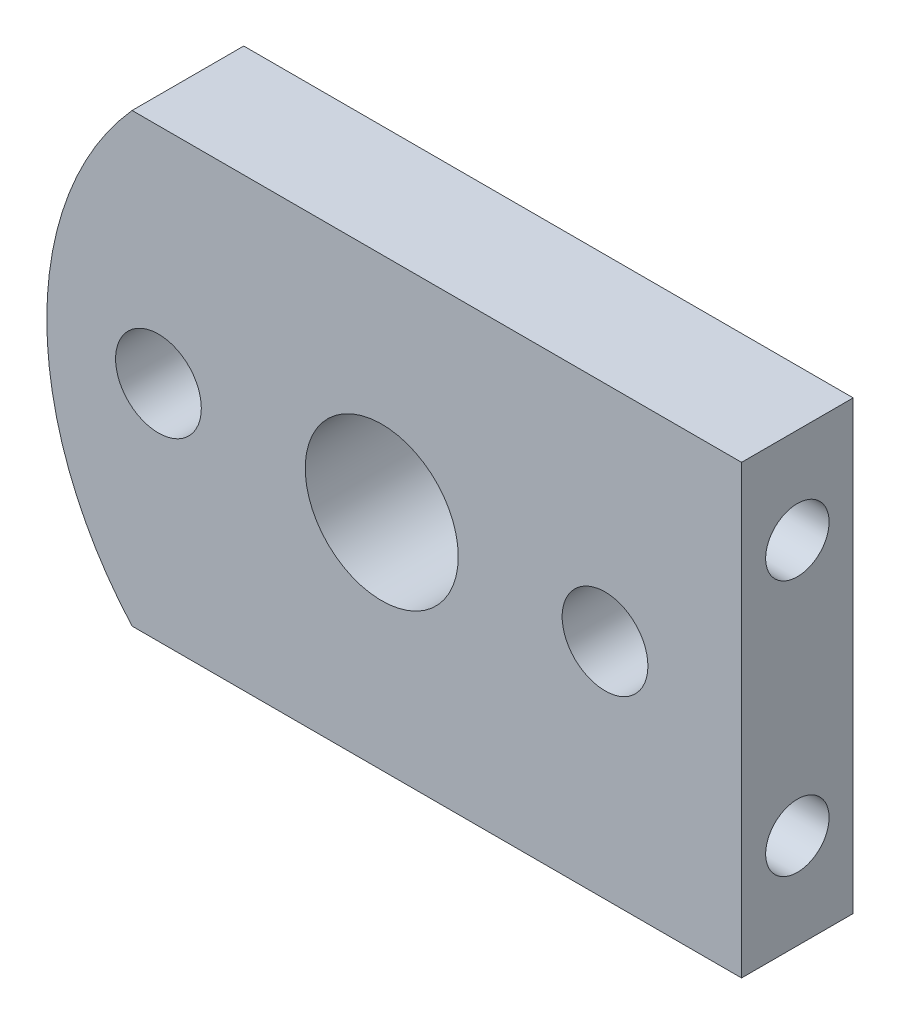
from build123d import *

# Parameters (mm, degrees)
SKETCH1_W                     = 44.45
SKETCH1_H                     = 23.0124
BOSS_EXTRUDE1_DEPTH           = 4.7625
F_1_4_CLEARANCE_HOLE1_D       = 6.5278
F_6_CLEARANCE_HOLE1_D         = 3.6576
CUT_EXTRUDE1_DEPTH            = 51.279761933
TAP_DRILL_FOR_6_32_TAP1_D     = 2.7051
TAP_DRILL_FOR_6_32_TAP1_DEPTH = 12.7
TAP_DRILL_FOR_6_32_TAP1_TIP   = 0.81269403


with BuildPart() as part:
    # Sketch1 → Boss-Extrude1 (new body)
    with BuildSketch(Plane.XY):
        with Locations((22.225, 11.5062)):
            Rectangle(SKETCH1_W, SKETCH1_H)
    extrude(amount=BOSS_EXTRUDE1_DEPTH)

    # 1/4 Clearance Hole1 (through all)
    with Locations(Plane.XY.offset(4.7625)):
        with Locations((29.1015, 10.3124)):
            Hole(F_1_4_CLEARANCE_HOLE1_D / 2)

    # #6 Clearance Hole1 (through all)
    with Locations(Plane.XY.offset(4.7625)):
        with Locations((19.5765, 10.3124), (38.6265, 10.3124)):
            Hole(F_6_CLEARANCE_HOLE1_D / 2)

    # Sketch7 → Cut-Extrude1 (cut, through all)
    with BuildSketch(Plane.XY.offset(4.7625)):
        with BuildLine():
            Line((18.452226257, 0.7874), (44.45, 0.7874))
            Line((44.45, 0.7874), (44.45, 0))
            Line((44.45, 0), (0, 0))
            Line((0, 0), (0, 23.0124))
            Line((0, 23.0124), (44.45, 23.0124))
            Line((44.45, 23.0124), (44.45, 19.8374))
            Line((44.45, 19.8374), (18.452226257, 19.8374))
            ThreePointArc((18.452226257, 19.8374), (14.814, 10.3124), (18.452226257, 0.7874))
        make_face()
    extrude(amount=-CUT_EXTRUDE1_DEPTH, mode=Mode.SUBTRACT)

    # Tap Drill for #6-32 Tap1
    with Locations(Plane(origin=(44.45, 0, 0), x_dir=(0, 0, -1), z_dir=(1, 0, 0))):
        with Locations((-2.38125, 4.8514), (-2.38125, 15.7734)):
            Hole(TAP_DRILL_FOR_6_32_TAP1_D / 2, depth=TAP_DRILL_FOR_6_32_TAP1_DEPTH)
            with Locations((0, 0, -(TAP_DRILL_FOR_6_32_TAP1_DEPTH + TAP_DRILL_FOR_6_32_TAP1_TIP / 2))):  # 118° drill point
                Cone(0, TAP_DRILL_FOR_6_32_TAP1_D / 2, TAP_DRILL_FOR_6_32_TAP1_TIP, mode=Mode.SUBTRACT)


solid = part.part
